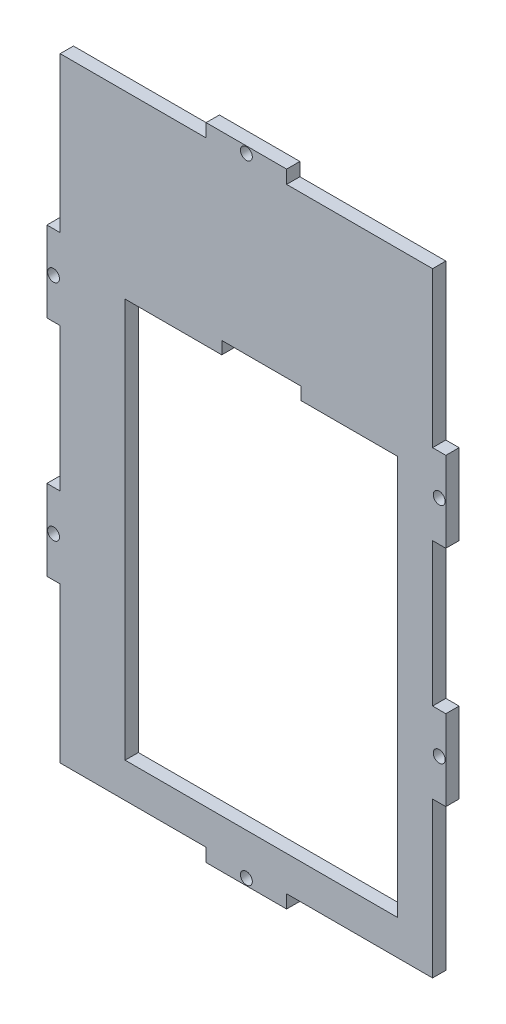
from build123d import *

# Parameters (mm, degrees)
BOSS_EXTRUDE1_DEPTH     = 3.18
CUT_EXTRUDE1_DEPTH      = 87.179315674
SKETCH27_W              = 3.18
SKETCH27_H              = 19.3
BOSS_EXTRUDE9_DEPTH     = 3.18
SKETCH28_W              = 19.3
SKETCH28_H              = 3.18
BOSS_EXTRUDE10_DEPTH    = 3.18
SKETCH29_R              = 1.425
CUT_EXTRUDE14_DEPTH     = 91.550668965
SKETCH30_R              = 1.425
CUT_EXTRUDE15_DEPTH     = 91.550668965
MIRROR9_COPY_1_SKETCH_W = 3.18
MIRROR9_COPY_1_SKETCH_H = 19.3
MIRROR9_COPY_1_DEPTH    = 3.18
MIRROR9_COPY_2_SKETCH_R = 1.425
MIRROR9_COPY_2_DEPTH    = 91.550668965


with BuildPart() as part:
    # Sketch1 → Boss-Extrude1 (new body)
    with BuildSketch(Plane.XY):
        Polygon((-44.645, 73.645), (-14.881666667, 73.645), (14.881666667, 73.645), (44.645, 73.645), (44.645, -73.645), (-44.645, -73.645), align=None)
    extrude(amount=BOSS_EXTRUDE1_DEPTH)

    # Sketch3 → Cut-Extrude1 (cut, through all)
    with BuildSketch(Plane(origin=(0, 0, 0), x_dir=(-1, 0, 0), z_dir=(0, 0, -1))):
        Polygon((-13.10174207, 33.47325793), (-13.10174207, 30.47325793), (-36.27674207, 30.47325793), (-36.27674207, -65.27674207), (29.07325793, -65.27674207), (29.07325793, 30.47325793), (5.89825793, 30.47325793), (5.89825793, 33.47325793), align=None)
    extrude(amount=-CUT_EXTRUDE1_DEPTH, mode=Mode.SUBTRACT)

    # Sketch27 → Boss-Extrude9 (add)
    with BuildSketch(Plane.ZY.offset(44.645)):
        with Locations((1.59, -26.825)):
            Rectangle(SKETCH27_W, SKETCH27_H)
    boss_extrude9 = extrude(amount=BOSS_EXTRUDE9_DEPTH)

    # Sketch28 → Boss-Extrude10 (add)
    with BuildSketch(Plane.XZ.offset(73.645)):
        with Locations((0, 1.59)):
            Rectangle(SKETCH28_W, SKETCH28_H)
    boss_extrude10 = extrude(amount=BOSS_EXTRUDE10_DEPTH)

    # Sketch29 → Cut-Extrude14 (cut, through all)
    with BuildSketch(Plane.XY.offset(3.18)):
        with Locations((-46.235, -26.825)):
            Circle(SKETCH29_R)
    cut_extrude14 = extrude(amount=-CUT_EXTRUDE14_DEPTH, mode=Mode.SUBTRACT)

    # Sketch30 → Cut-Extrude15 (cut, through all)
    with BuildSketch(Plane.XY.offset(3.18)):
        with Locations((0, -75.235)):
            Circle(SKETCH30_R)
    cut_extrude15 = extrude(amount=-CUT_EXTRUDE15_DEPTH, mode=Mode.SUBTRACT)

    # Mirror8: Boss-Extrude9, Cut-Extrude14 across plane
    add(boss_extrude9.mirror(Plane(origin=(0, 0, 0), x_dir=(0, 0, 1), z_dir=(1, 0, 0))))
    add(cut_extrude14.mirror(Plane(origin=(0, 0, 0), x_dir=(0, 0, 1), z_dir=(1, 0, 0))), mode=Mode.SUBTRACT)

    # Mirror9: Boss-Extrude9, Boss-Extrude10, Cut-Extrude14, Cut-Extrude15 across plane
    add(boss_extrude9.mirror(Plane.ZX))
    add(boss_extrude10.mirror(Plane.ZX))
    add(cut_extrude14.mirror(Plane.ZX), mode=Mode.SUBTRACT)
    add(cut_extrude15.mirror(Plane.ZX), mode=Mode.SUBTRACT)

    # Mirror9 copy 1 sketch → Mirror9 copy 1 (add)
    with BuildSketch(Plane(origin=(44.645, 0, 0), x_dir=(0, 0, 1), z_dir=(1, 0, 0))):
        with Locations((1.59, -26.825)):
            Rectangle(MIRROR9_COPY_1_SKETCH_W, MIRROR9_COPY_1_SKETCH_H)
    extrude(amount=MIRROR9_COPY_1_DEPTH)

    # Mirror9 copy 2 sketch → Mirror9 copy 2 (cut, through all)
    with BuildSketch(Plane(origin=(0, 0, 3.18), x_dir=(-1, 0, 0), z_dir=(0, 0, 1))):
        with Locations((-46.235, -26.825)):
            Circle(MIRROR9_COPY_2_SKETCH_R)
    extrude(amount=-MIRROR9_COPY_2_DEPTH, mode=Mode.SUBTRACT)


solid = part.part
